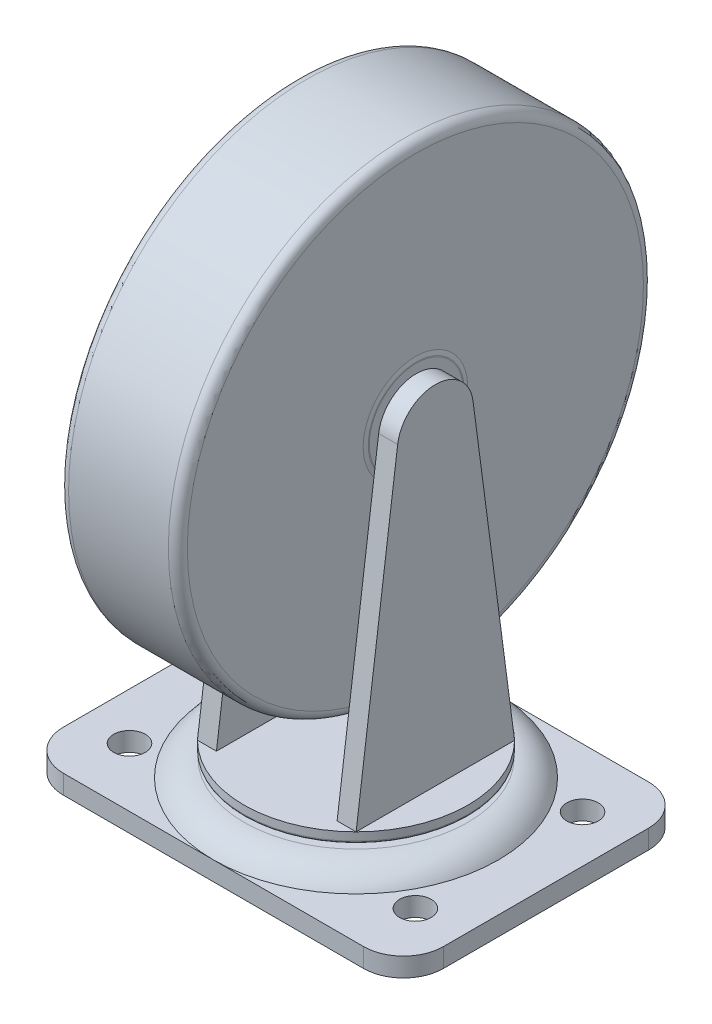
from build123d import *

# Parameters (mm, degrees)
SKETCH1_R               = 4.2164
MOUNTING_PLATE_MP_DEPTH = 5.08
WHEEL_SUPPORT_1_DEPTH   = 5.08
FILLET1_R               = 2.54
FILLET2_R               = 0.635


with BuildPart() as part:
    # Sketch1 → Mounting Plate (MP) (new body)
    with BuildSketch(Plane(origin=(0, 0, 0), x_dir=(1, 0, 0), z_dir=(0, 1, 0))):
        with BuildLine():
            Line((-40.132, 38.1), (40.132, 38.1))
            ThreePointArc((40.132, 38.1), (47.675415142, 34.975415142), (50.8, 27.432))
            Line((50.8, 27.432), (50.8, -27.432))
            ThreePointArc((50.8, -27.432), (47.675415142, -34.975415142), (40.132, -38.1))
            Line((40.132, -38.1), (-40.132, -38.1))
            ThreePointArc((-40.132, -38.1), (-47.675415142, -34.975415142), (-50.8, -27.432))
            Line((-50.8, -27.432), (-50.8, 27.432))
            ThreePointArc((-50.8, 27.432), (-47.675415142, 34.975415142), (-40.132, 38.1))
        make_face()
        with Locations(Location((38.2143, 22.3393, 0), (0, 0, 270))):
            Circle(SKETCH1_R, mode=Mode.SUBTRACT)
        with Locations(Location((-38.2143, 22.3393, 0), (0, 0, 270))):
            Circle(SKETCH1_R, mode=Mode.SUBTRACT)
        with Locations(Location((-38.2143, -22.3393, 0), (0, 0, 270))):
            Circle(SKETCH1_R, mode=Mode.SUBTRACT)
        with Locations(Location((38.2143, -22.3393, 0), (0, 0, 270))):
            Circle(SKETCH1_R, mode=Mode.SUBTRACT)
    extrude(amount=MOUNTING_PLATE_MP_DEPTH)

    # Sketch2 → MP Bearing Retainer (revolve)
    with BuildSketch(Plane.XY, mode=Mode.PRIVATE) as mp_bearing_retainer_sk:
        with BuildLine():
            Line((0, 9.652), (-29.893008834, 9.652))
            ThreePointArc((-29.893008834, 9.652), (-34.590292304, 8.431881878), (-38.1, 5.08))
            Line((-38.1, 5.08), (0, 5.08))
            Line((0, 5.08), (0, 9.652))
        make_face()
    revolve(mp_bearing_retainer_sk.sketch.rotate(Axis((0, 5.08, 0), (0, 1, 0)), 270), axis=Axis((0, 5.08, 0), (0, 1, 0)))

    # Sketch3 → Caster Wheel Base (revolve)
    with BuildSketch(Plane.XY):
        Polygon((0, 9.652), (-6.35, 9.652), (-6.35, 10.922), (-29.972, 10.922), (-29.972, 13.716), (0, 13.716), align=None)
    revolve(axis=Axis((0, 13.716, 0), (0, -1, 0)))

    # Sketch7 → Wheel Support 1 (add)
    with BuildSketch(Plane.ZY.offset(-21.209)):
        with BuildLine():
            Line((10.072633417, 97.849532267), (21.177797407, 13.716))
            Line((21.177797407, 13.716), (-21.177797407, 13.716))
            Line((-21.177797407, 13.716), (-10.072633417, 97.849532267))
            ThreePointArc((-10.072633417, 97.849532267), (0, 106.68), (10.072633417, 97.849532267))
        make_face()
    wheel_support_1 = extrude(amount=WHEEL_SUPPORT_1_DEPTH)

    # Wheel Support 2: Wheel Support 1 across plane
    add(wheel_support_1.mirror(Plane.ZY))

    # Sketch9 → Revolve3 (revolve)
    with BuildSketch(Plane(origin=(0, 96.52, 0), x_dir=(1, 0, 0), z_dir=(0, 1, 0)), mode=Mode.PRIVATE) as revolve3_sk:
        with BuildLine():
            Line((-16.129, 0), (16.129, 0))
            Line((16.129, 0), (16.129, 12.574245218))
            ThreePointArc((16.129, 12.574245218), (16.122819325, 12.699387993), (16.104337458, 12.823312709))
            Line((16.104337458, 12.823312709), (15.875, 13.97))
            Line((15.875, 13.97), (15.875, 63.5))
            Line((15.875, 63.5), (-15.875, 63.5))
            Line((-15.875, 63.5), (-15.875, 13.97))
            Line((-15.875, 13.97), (-16.104337458, 12.823312709))
            ThreePointArc((-16.104337458, 12.823312709), (-16.122819325, 12.699387993), (-16.129, 12.574245218))
            Line((-16.129, 12.574245218), (-16.129, 0))
        make_face()
    revolve(revolve3_sk.sketch.rotate(Axis((-16.129, 96.52, 0), (1, 0, 0)), 180), axis=Axis((-16.129, 96.52, 0), (1, 0, 0)))

    # Fillet1
    fillet1_edges = [part.edges().sort_by_distance(p)[0] for p in [
        (15.875, 96.52, -63.5),
        (-15.875, 96.52, -63.5),
    ]]
    fillet(fillet1_edges, radius=FILLET1_R)

    # Fillet2
    fillet2_edges = [part.edges().sort_by_distance(p)[0] for p in [
        (29.972, 10.922, 0),
    ]]
    fillet(fillet2_edges, radius=FILLET2_R)


solid = part.part
